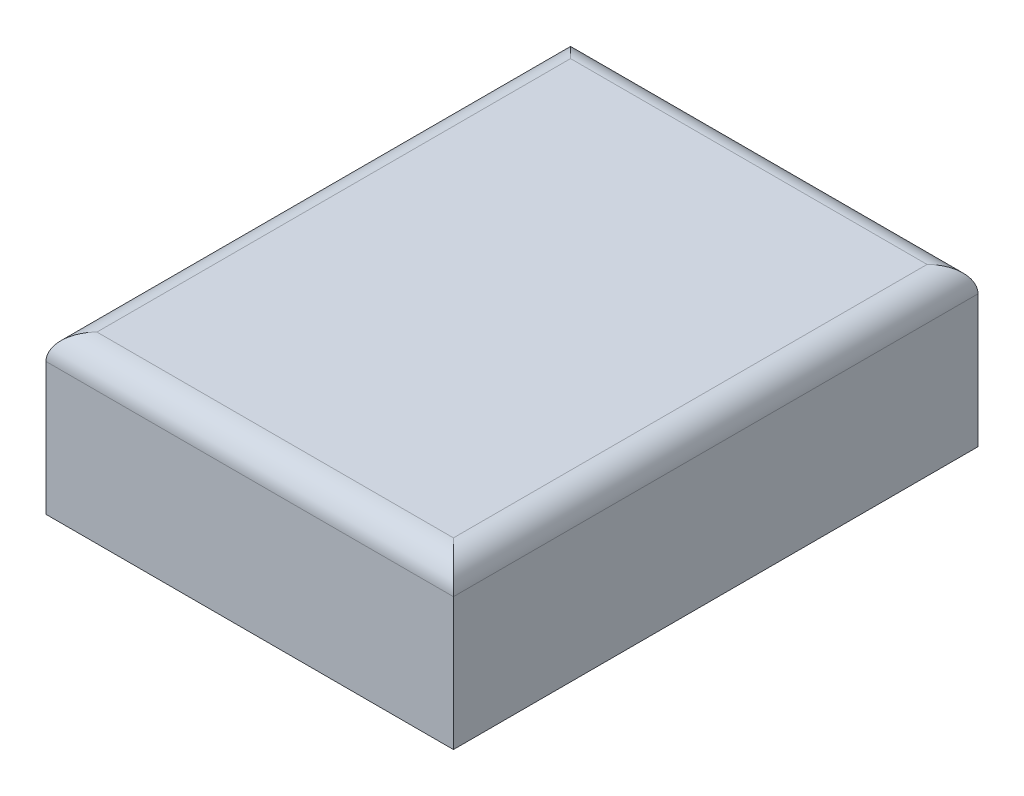
from build123d import *

# Parameters (mm, degrees)
SKETCH1_W           = 1.6
SKETCH1_H           = 2.06
BOSS_EXTRUDE1_DEPTH = 0.62
FILLET1_R           = 0.1


with BuildPart() as part:
    # Sketch1 → Boss-Extrude1 (new body)
    with BuildSketch(Plane(origin=(0, 0, 0), x_dir=(1, 0, 0), z_dir=(0, 1, 0))):
        Rectangle(SKETCH1_W, SKETCH1_H)
    extrude(amount=BOSS_EXTRUDE1_DEPTH)

    # Fillet1
    fillet1_edges = [part.edges().sort_by_distance(p)[0] for p in [
        (-0.8, 0.62, 0),
        (0, 0.62, 1.03),
        (0.8, 0.62, 0),
        (0, 0.62, -1.03),
    ]]
    fillet(fillet1_edges, radius=FILLET1_R)


solid = part.part
